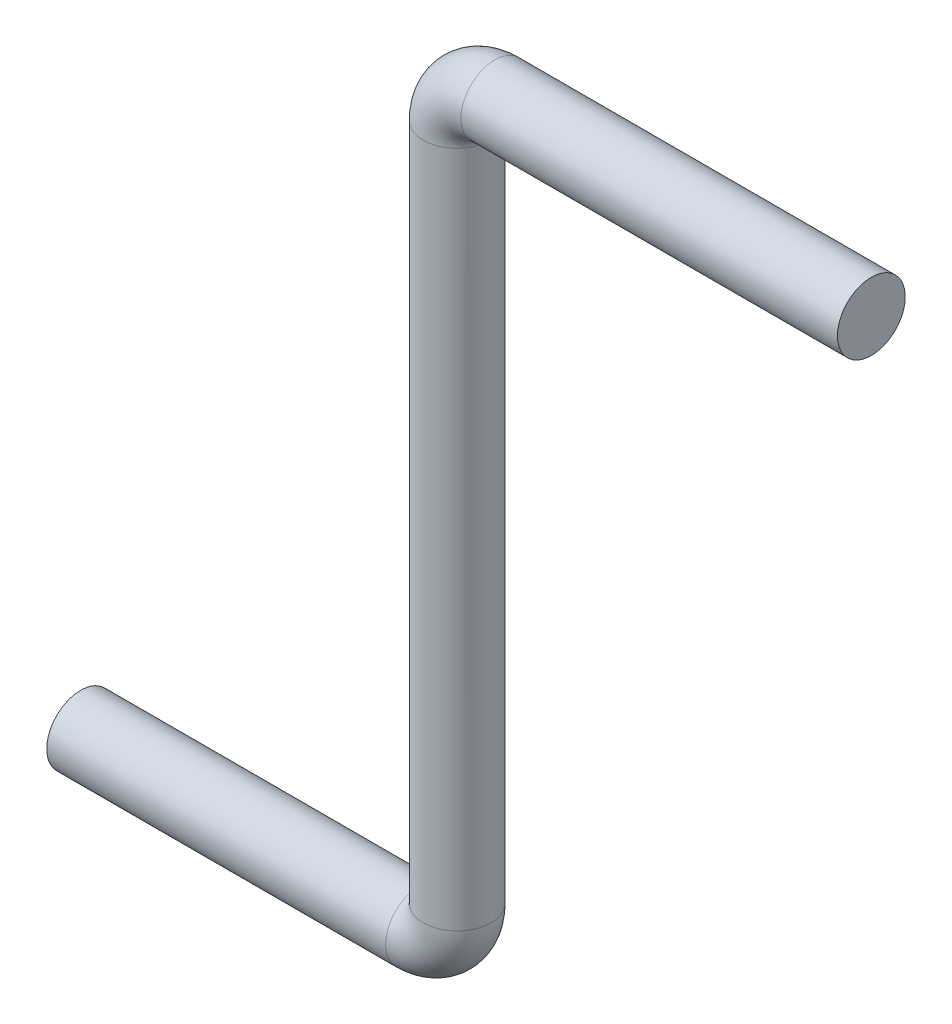
from build123d import *

# Parameters (mm, degrees)
SWEEP1_PROFILE_R = 0.45


with BuildPart() as part:
    # Sweep1: sweep along a path in Sketch1
    with BuildLine(Plane.XY) as sweep1_path:
        Line((-5, -5), (-0.5, -5))
        ThreePointArc((-0.5, -5), (-0.146446609, -4.853553391), (0, -4.5))
        Line((0, -4.5), (0, 4.5))
        ThreePointArc((0, 4.5), (0.146446609, 4.853553391), (0.5, 5))
        Line((0.5, 5), (5.5, 5))
    # Sweep1 profile (on start of the path) → Sweep1 (sweep)
    with BuildSketch(Plane(origin=(-5, -5, 0), x_dir=(0, 0, 1), z_dir=(1, 0, 0))):
        Circle(SWEEP1_PROFILE_R)
    sweep(path=sweep1_path.line)


solid = part.part
